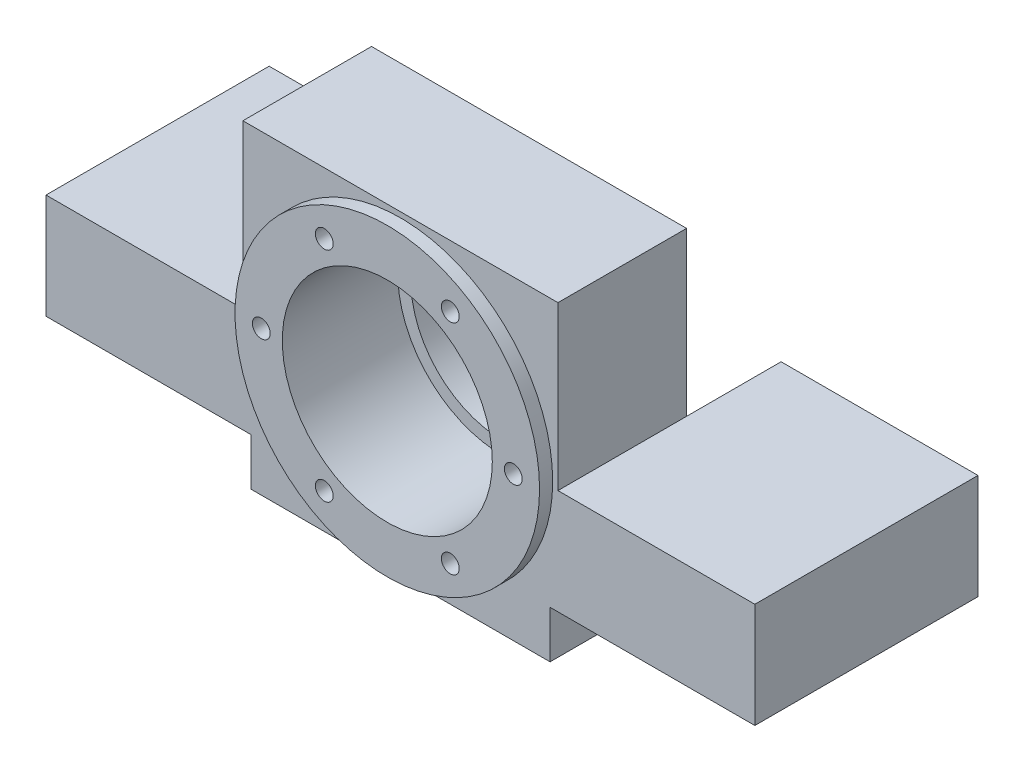
from build123d import *

# Parameters (mm, degrees)
EXTRUDE_1_DEPTH          = 85
SKETCH_2_R               = 58
EXTRUDE_2_DEPTH          = 5
SKETCH_3_R               = 40
CUT_EXTRUDE_1_DEPTH      = 44
SKETCH_4_R               = 35
CUT_EXTRUDE_2_DEPTH      = 187.38937738
PATTERN_CIRCULAR_1_COUNT = 6
SKETCH_8_W               = 120
SKETCH_8_H               = 36
CUT_EXTRUDE_3_DEPTH      = 200.624647777


with BuildPart() as part:
    # 草图1 → 凸台-拉伸1 (new body)
    with BuildSketch(Plane.XY):
        Polygon((0, 0), (-57, 0), (-57, 18), (-135, 18), (-135, 58), (-60, 58), (-60, 120), (60, 120), (60, 58), (135, 58), (135, 18), (57, 18), (57, 0), align=None)
    extrude(amount=-EXTRUDE_1_DEPTH)

    # 草图2 → 凸台-拉伸2 (add)
    with BuildSketch(Plane.XY):
        with Locations((0, 60)):
            Circle(SKETCH_2_R)
    extrude(amount=EXTRUDE_2_DEPTH)

    # 草图3 → 切除-拉伸1 (cut)
    with BuildSketch(Plane.XY.offset(5)):
        with Locations((0, 60)):
            Circle(SKETCH_3_R)
    extrude(amount=-CUT_EXTRUDE_1_DEPTH, mode=Mode.SUBTRACT)

    # 草图4 → 切除-拉伸2 (cut, through all)
    with BuildSketch(Plane.XY.offset(-39)):
        with Locations((0, 60)):
            Circle(SKETCH_4_R)
    extrude(amount=-CUT_EXTRUDE_2_DEPTH, mode=Mode.SUBTRACT)

    # 草图7 → M8 螺纹孔1 (revolve, cut)
    with BuildSketch(Plane(origin=(24, 101.569219382, 5), x_dir=(0, -1, 0), z_dir=(1, 0, 0))):
        Polygon((0, 0), (0, 29.802926105), (3.4, 27.76), (3.4, 0), align=None)
    hole_wizard_m8_1 = revolve(axis=Axis((24, 101.569219382, 11.35), (0, 0, -1)), mode=Mode.SUBTRACT)

    # 阵列(圆周)1: M8 螺纹孔1 ×6 about axis
    pattern_circular_1_axis = Axis((0, 60, 0), (0, 0, 1))
    for i in range(1, PATTERN_CIRCULAR_1_COUNT):
        add(hole_wizard_m8_1.rotate(pattern_circular_1_axis, i * 360 / PATTERN_CIRCULAR_1_COUNT), mode=Mode.SUBTRACT)

    # 草图8 → 切除-拉伸3 (cut, through all)
    with BuildSketch(Plane(origin=(0, 120, 0), x_dir=(1, 0, 0), z_dir=(0, 1, 0))):
        with Locations((0, 67)):
            Rectangle(SKETCH_8_W, SKETCH_8_H)
    extrude(amount=-CUT_EXTRUDE_3_DEPTH, mode=Mode.SUBTRACT)


solid = part.part
